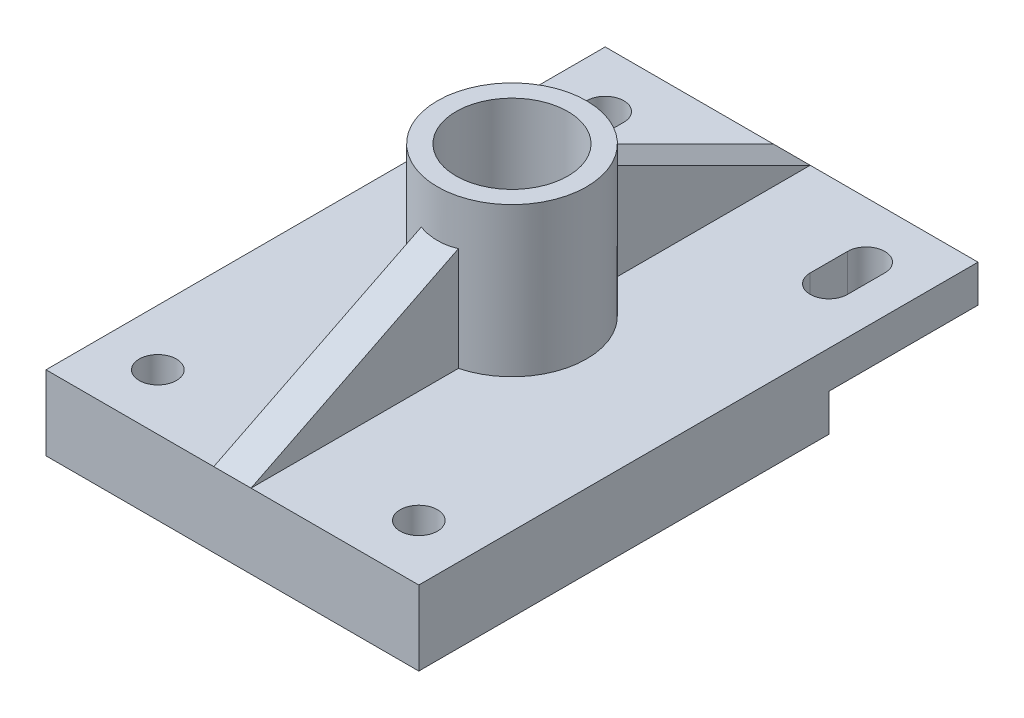
from build123d import *

# Parameters (mm, degrees)
SKETCH_2_W          = 100
SKETCH_2_H          = 150
EXTRUDE_2_DEPTH     = 20
SKETCH_3_W          = 40
SKETCH_3_H          = 10
CUT_EXTRUDE_1_DEPTH = 127.589889012
SKETCH_5_R          = 5
CUT_EXTRUDE_3_DEPTH = 93.330926563
SKETCH_6_R          = 20
SKETCH_6_R_2        = 15
EXTRUDE_6_DEPTH     = 40
EXTRUDE_9_DEPTH     = 5
CUT_EXTRUDE_2_DEPTH = 99.615414617


with BuildPart() as part:
    # Эскиз2 → Бобышка-Вытянуть2 (new body)
    with BuildSketch(Plane(origin=(0, 0, 0), x_dir=(1, 0, 0), z_dir=(0, 1, 0))):
        Rectangle(SKETCH_2_W, SKETCH_2_H)
    extrude(amount=-EXTRUDE_2_DEPTH)

    # Эскиз3 → Вырез-Вытянуть1 (cut, through all)
    with BuildSketch(Plane(origin=(50, 0, 0), x_dir=(0, 0, -1), z_dir=(1, 0, 0))):
        with Locations((55, -15)):
            Rectangle(SKETCH_3_W, SKETCH_3_H)
    extrude(amount=-CUT_EXTRUDE_1_DEPTH, mode=Mode.SUBTRACT)

    # Эскиз5 → Вырез-Вытянуть3 (cut, through all)
    with BuildSketch(Plane(origin=(0, 0, 0), x_dir=(1, 0, 0), z_dir=(0, 1, 0))):
        with Locations(Location((-35, -60, 0), (0, 0, 270))):
            Circle(SKETCH_5_R)
        with BuildLine():
            Line((-30, 60), (-30, 50))
            ThreePointArc((-30, 50), (-35, 45), (-40, 50))
            Line((-40, 50), (-40, 60))
            ThreePointArc((-40, 60), (-35, 65), (-30, 60))
        make_face()
    cut_extrude_3 = extrude(amount=-CUT_EXTRUDE_3_DEPTH, mode=Mode.SUBTRACT)

    # Зеркальное отражение2: Вырез-Вытянуть3 across plane
    add(cut_extrude_3.mirror(Plane(origin=(0, 0, 0), x_dir=(0, 0, 1), z_dir=(1, 0, 0))), mode=Mode.SUBTRACT)

    # Эскиз6 → Бобышка-Вытянуть6 (add)
    with BuildSketch(Plane(origin=(0, 0, 0), x_dir=(1, 0, 0), z_dir=(0, 1, 0))):
        with Locations(Location((0, 0, 0), (0, 0, 90))):
            Circle(SKETCH_6_R)
        with Locations(Location((0, 0, 0), (0, 0, 270))):
            Circle(SKETCH_6_R_2, mode=Mode.SUBTRACT)
    extrude(amount=EXTRUDE_6_DEPTH)

    # Эскиз7 → Бобышка-Вытянуть9 (add, symmetric)
    with BuildSketch(Plane(origin=(0, 0, 0), x_dir=(0, 0, -1), z_dir=(1, 0, 0))):
        Polygon((-75, 0), (-15, 30), (-15, 0), align=None)
    extrude_9 = extrude(amount=EXTRUDE_9_DEPTH, both=True)

    # Зеркальное отражение3: Бобышка-Вытянуть9 across plane
    add(extrude_9.mirror(Plane.XY))

    # Эскиз4 → Вырез-Вытянуть2 (cut, through all)
    with BuildSketch(Plane(origin=(0, 0, 0), x_dir=(1, 0, 0), z_dir=(0, 1, 0))):
        with BuildLine():
            Line((-30, 60), (-30, 50))
            ThreePointArc((-30, 50), (-35, 45), (-40, 50))
            Line((-40, 50), (-40, 60))
            ThreePointArc((-40, 60), (-35, 65), (-30, 60))
        make_face()
    extrude(amount=-CUT_EXTRUDE_2_DEPTH, mode=Mode.SUBTRACT)


solid = part.part
